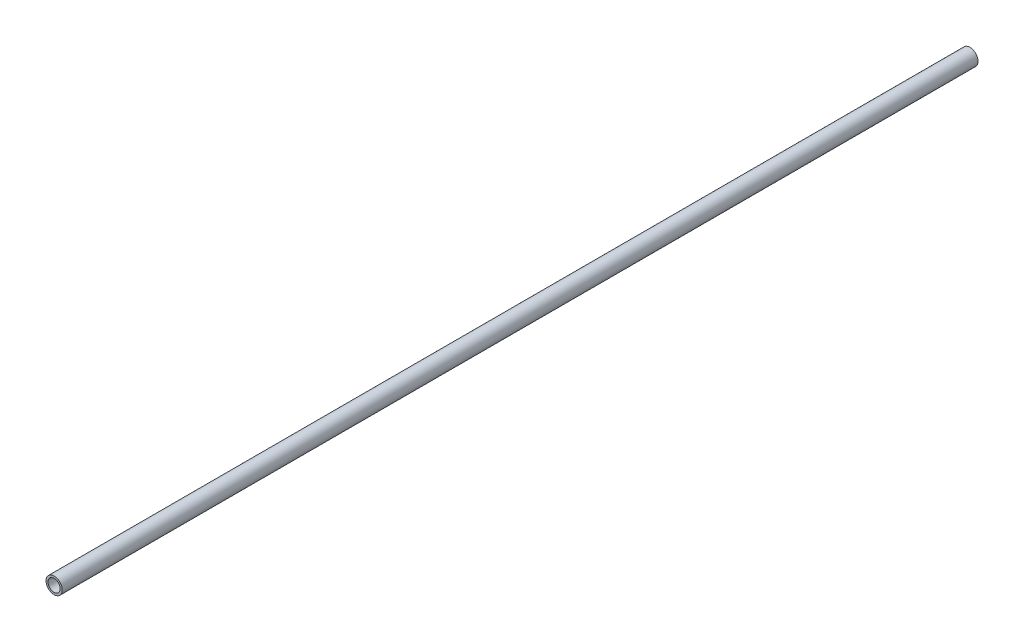
from build123d import *

# Parameters (mm, degrees)
SKETCH1_R           = 2
SKETCH1_R_2         = 1.5
BOSS_EXTRUDE1_DEPTH = 226.06


with BuildPart() as part:
    # Sketch1 → Boss-Extrude1 (new body)
    with BuildSketch(Plane.XY):
        with Locations(Location((0, 0, 0), (0, 0, 180))):
            Circle(SKETCH1_R)
        with Locations(Location((0, 0, 0), (0, 0, 180))):
            Circle(SKETCH1_R_2, mode=Mode.SUBTRACT)
    extrude(amount=BOSS_EXTRUDE1_DEPTH)


solid = part.part
